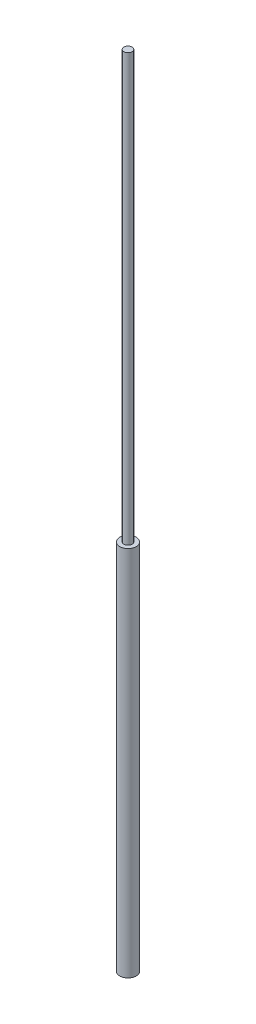
from build123d import *

# Parameters (mm, degrees)
SKETCH1_R           = 0.75
BOSS_EXTRUDE1_DEPTH = 34
SKETCH2_R           = 0.375
BOSS_EXTRUDE2_DEPTH = 39


with BuildPart() as part:
    # Sketch1 → Boss-Extrude1 (new body)
    with BuildSketch(Plane(origin=(0, 0, 0), x_dir=(1, 0, 0), z_dir=(0, 1, 0))):
        with Locations(Location((0, 0, 0), (0, 0, 270))):
            Circle(SKETCH1_R)
    extrude(amount=BOSS_EXTRUDE1_DEPTH)

    # Sketch2 → Boss-Extrude2 (add)
    with BuildSketch(Plane(origin=(0, 34, 0), x_dir=(1, 0, 0), z_dir=(0, 1, 0))):
        with Locations(Location((0, 0, 0), (0, 0, 270))):
            Circle(SKETCH2_R)
    extrude(amount=BOSS_EXTRUDE2_DEPTH)


solid = part.part
